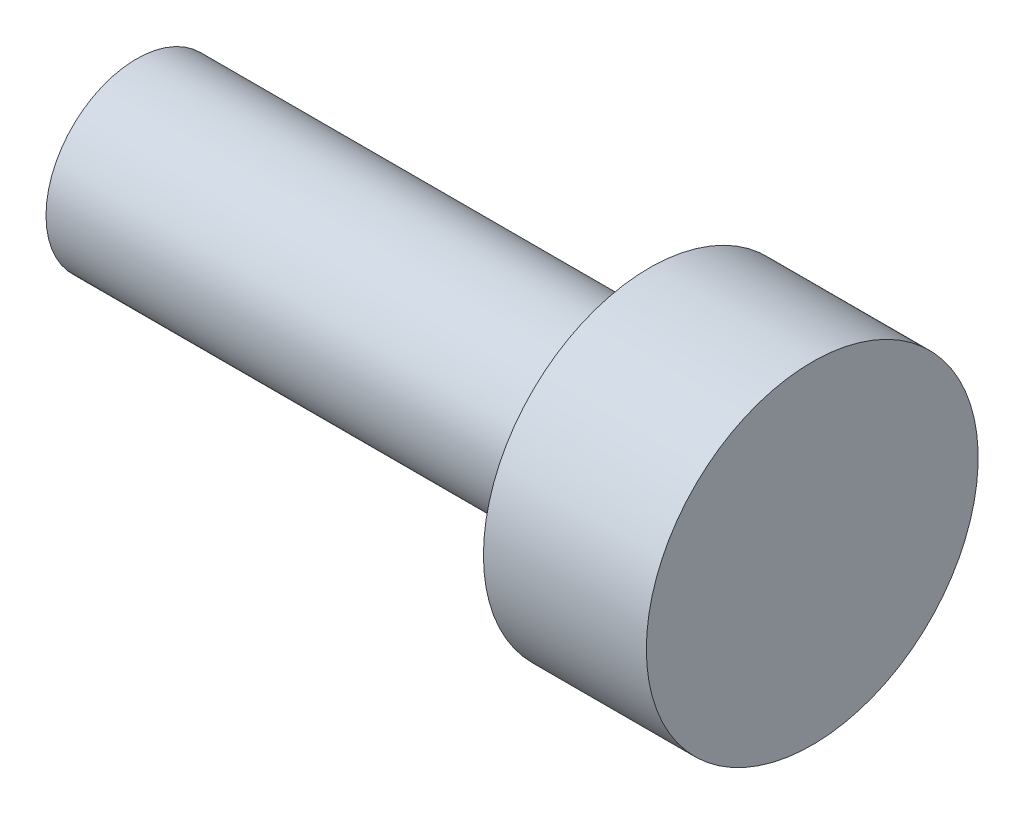
from build123d import *


with BuildPart() as part:
    # Axial profile (mm) → Full revolution (revolve)
    with BuildSketch(Plane.XY, mode=Mode.PRIVATE) as full_revolution_sk:
        Polygon((165.5, 0), (176.7, 0), (176.7, 2.75), (174, 2.75), (174, 1.5), (165.5, 1.5), align=None)
    revolve(full_revolution_sk.sketch.rotate(Axis((-110, 0, 0), (1, 0, 0)), 90), axis=Axis((-110, 0, 0), (1, 0, 0)))


solid = part.part
